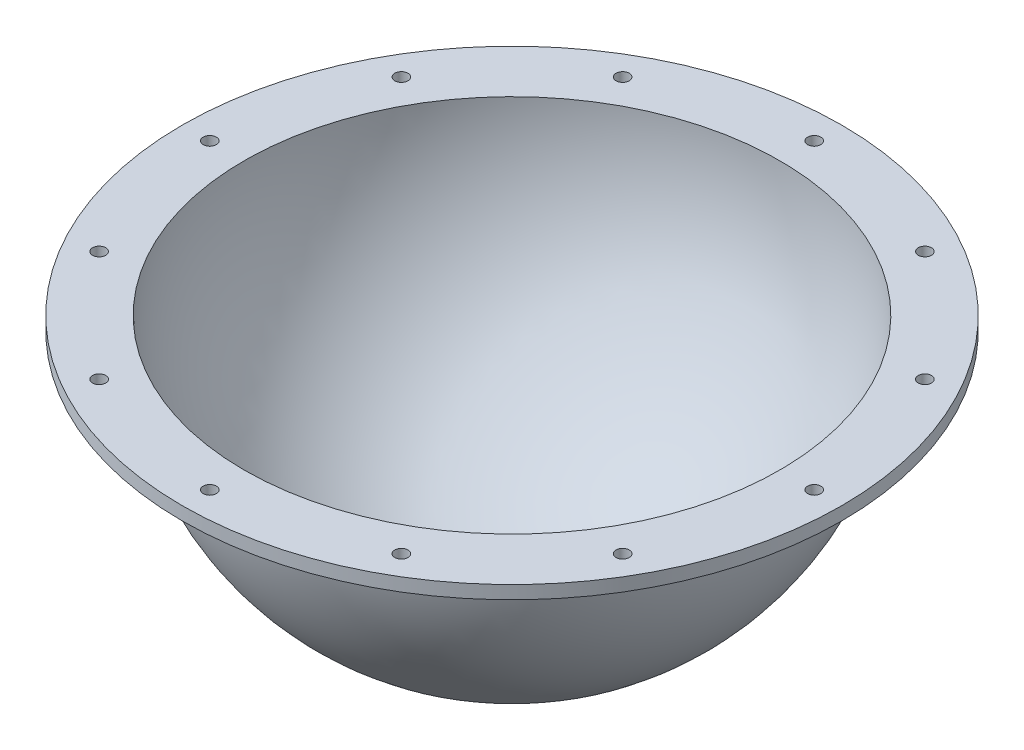
from build123d import *

# Parameters (mm, degrees)
REVOLVE1_ANGLE     = 180
SKETCH10_R         = 6
CUT_EXTRUDE1_DEPTH = 493.44289009


with BuildPart() as part:
    # Sketch1 → Revolve1 (revolve)
    with BuildSketch(Plane(origin=(0, 0, 0), x_dir=(1, 0, 0), z_dir=(0, 1, 0))):
        with BuildLine():
            Line((0, 250), (0, 243.75))
            ThreePointArc((0, 243.75), (-243.75, 0), (0, -243.75))
            Line((0, -243.75), (0, -250))
            ThreePointArc((0, -250), (-250, 0), (0, 250))
        make_face()
    revolve(axis=Axis((0, 0, -250), (0, 0, 1)), revolution_arc=REVOLVE1_ANGLE)

    # Sketch3 → Revolve2 (revolve)
    with BuildSketch(Plane(origin=(0, 0, 0), x_dir=(0, 0, -1), z_dir=(1, 0, 0)), mode=Mode.PRIVATE) as revolve2_sk:
        with BuildLine():
            Line((-250, 0), (-300, 0))
            Line((-300, 0), (-300, -12))
            Line((-300, -12), (-249.711833921, -12))
            ThreePointArc((-249.711833921, -12), (-249.927948097, -6.001729744), (-250, 0))
        make_face()
    revolve(revolve2_sk.sketch.rotate(Axis((0, 0, 0), (0, 1, 0)), 180), axis=Axis((0, 0, 0), (0, 1, 0)))

    # Sketch10 → Cut-Extrude1 (cut, through all)
    with BuildSketch(Plane(origin=(0, 0, 0), x_dir=(1, 0, 0), z_dir=(0, 1, 0))):
        with Locations(Location((0, 275, 0), (0, 0, 180))):
            Circle(SKETCH10_R)
        with Locations(Location((-137.5, 238.156986041, 0), (0, 0, 180))):
            Circle(SKETCH10_R)
        with Locations(Location((-238.156986041, 137.5, 0), (0, 0, 180))):
            Circle(SKETCH10_R)
        with Locations(Location((-275, 0, 0), (0, 0, 180))):
            Circle(SKETCH10_R)
        with Locations(Location((-238.156986041, -137.5, 0), (0, 0, 180))):
            Circle(SKETCH10_R)
        with Locations(Location((-137.5, -238.156986041, 0), (0, 0, 180))):
            Circle(SKETCH10_R)
        with Locations(Location((0, -275, 0), (0, 0, 180))):
            Circle(SKETCH10_R)
        with Locations(Location((137.5, -238.156986041, 0), (0, 0, 180))):
            Circle(SKETCH10_R)
        with Locations(Location((238.156986041, -137.5, 0), (0, 0, 180))):
            Circle(SKETCH10_R)
        with Locations(Location((275, 0, 0), (0, 0, 180))):
            Circle(SKETCH10_R)
        with Locations(Location((238.156986041, 137.5, 0), (0, 0, 180))):
            Circle(SKETCH10_R)
        with Locations(Location((137.5, 238.156986041, 0), (0, 0, 180))):
            Circle(SKETCH10_R)
    extrude(amount=-CUT_EXTRUDE1_DEPTH, mode=Mode.SUBTRACT)


solid = part.part
